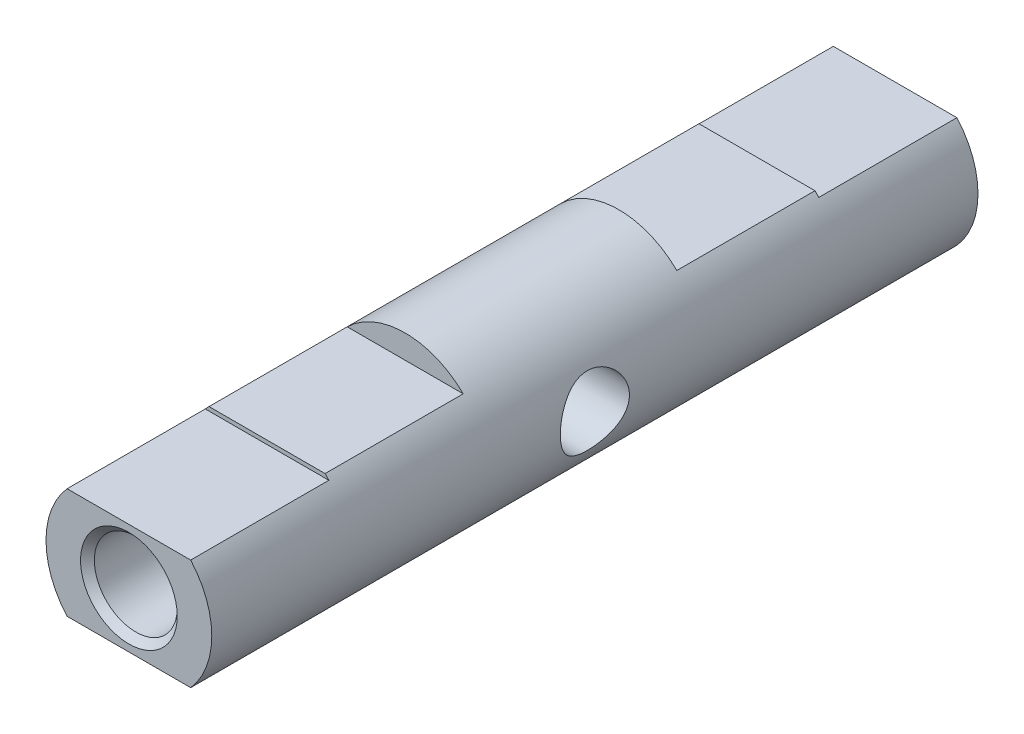
from build123d import *

# Parameters (mm, degrees)
BOSS_EXTRUDE1_DEPTH                                 = 13.865
BOSS_EXTRUDE1_DEPTH_BACK                            = 13.865
SKETCH1_R                                           = 3
CUT_EXTRUDE1_DEPTH                                  = 5
CUT_EXTRUDE2_DEPTH                                  = 5
CUT_EXTRUDE5_DEPTH                                  = 5
CUT_EXTRUDE6_START                                  = -5
CUT_EXTRUDE6_DEPTH                                  = 5
CSK_FOR_M3_COUNTERSUNK_FLAT_HEAD_SCREW1_D           = 3
CSK_FOR_M3_COUNTERSUNK_FLAT_HEAD_SCREW1_DEPTH       = 9.098709071
CSK_FOR_M3_COUNTERSUNK_FLAT_HEAD_SCREW1_CSINK_D     = 3.5
CSK_FOR_M3_COUNTERSUNK_FLAT_HEAD_SCREW1_CSINK_ANGLE = 90
CSK_FOR_M3_COUNTERSUNK_FLAT_HEAD_SCREW1_TIP         = 0.901290929
CSK_FOR_M3_COUNTERSUNK_FLAT_HEAD_SCREW2_D           = 3
CSK_FOR_M3_COUNTERSUNK_FLAT_HEAD_SCREW2_DEPTH       = 9.098709071
CSK_FOR_M3_COUNTERSUNK_FLAT_HEAD_SCREW2_CSINK_D     = 3.5
CSK_FOR_M3_COUNTERSUNK_FLAT_HEAD_SCREW2_CSINK_ANGLE = 90
CSK_FOR_M3_COUNTERSUNK_FLAT_HEAD_SCREW2_TIP         = 0.901290929
SKETCH14_W                                          = 7.4
SKETCH14_H                                          = 4
CUT_EXTRUDE9_DEPTH                                  = 3
SKETCH15_R                                          = 1.25
CUT_EXTRUDE10_DEPTH                                 = 16.157632566


with BuildPart() as part:
    # Sketch1 → Boss-Extrude1 (new, two sides: drawn at the far end of the back side and taken through both)
    with BuildSketch(Plane.XY.offset(-BOSS_EXTRUDE1_DEPTH_BACK)):
        Circle(SKETCH1_R)
    extrude(amount=BOSS_EXTRUDE1_DEPTH + BOSS_EXTRUDE1_DEPTH_BACK)

    # Sketch2 → Cut-Extrude1 (cut)
    with BuildSketch(Plane.XY.offset(13.865)):
        with BuildLine():
            Line((-2.236067977, 2), (2.236067977, 2))
            ThreePointArc((2.236067977, 2), (0, 3), (-2.236067977, 2))
        make_face()
        with BuildLine():
            Line((-2.236067977, -2), (2.236067977, -2))
            ThreePointArc((2.236067977, -2), (0, -3), (-2.236067977, -2))
        make_face()
    extrude(amount=-CUT_EXTRUDE1_DEPTH, mode=Mode.SUBTRACT)

    # Sketch3 → Cut-Extrude2 (cut)
    with BuildSketch(Plane(origin=(0, 0, -13.865), x_dir=(-1, 0, 0), z_dir=(0, 0, -1))):
        with BuildLine():
            Line((-2.236067977, 2), (2.236067977, 2))
            ThreePointArc((2.236067977, 2), (0, 3), (-2.236067977, 2))
        make_face()
        with BuildLine():
            Line((-2.236067977, -2), (2.236067977, -2))
            ThreePointArc((2.236067977, -2), (0, -3), (-2.236067977, -2))
        make_face()
    extrude(amount=-CUT_EXTRUDE2_DEPTH, mode=Mode.SUBTRACT)

    # Sketch4 → Cut-Extrude5 (cut)
    with BuildSketch(Plane(origin=(0, 0, -8.865), x_dir=(-1, 0, 0), z_dir=(0, 0, -1))):
        with BuildLine():
            Line((-2.1, 2.142428529), (2.1, 2.142428529))
            ThreePointArc((2.1, 2.142428529), (0, 3), (-2.1, 2.142428529))
        make_face()
    extrude(amount=-CUT_EXTRUDE5_DEPTH, mode=Mode.SUBTRACT)

    # Sketch5 → Cut-Extrude6 (cut)
    with BuildSketch(Plane.XY.offset(8.865).offset(CUT_EXTRUDE6_START)):
        with BuildLine():
            Line((-2.1, 2.142428529), (2.1, 2.142428529))
            ThreePointArc((2.1, 2.142428529), (0, 3), (-2.1, 2.142428529))
        make_face()
    extrude(amount=CUT_EXTRUDE6_DEPTH, mode=Mode.SUBTRACT)

    # CSK for M3 Countersunk Flat Head Screw1
    with Locations(Plane(origin=(0, 0, -13.865), x_dir=(-1, 0, 0), z_dir=(0, 0, -1))):
        with Locations((0, 0)):
            CounterSinkHole(CSK_FOR_M3_COUNTERSUNK_FLAT_HEAD_SCREW1_D / 2, CSK_FOR_M3_COUNTERSUNK_FLAT_HEAD_SCREW1_CSINK_D / 2, depth=CSK_FOR_M3_COUNTERSUNK_FLAT_HEAD_SCREW1_DEPTH, counter_sink_angle=CSK_FOR_M3_COUNTERSUNK_FLAT_HEAD_SCREW1_CSINK_ANGLE)
            with Locations((0, 0, -(CSK_FOR_M3_COUNTERSUNK_FLAT_HEAD_SCREW1_DEPTH + CSK_FOR_M3_COUNTERSUNK_FLAT_HEAD_SCREW1_TIP / 2))):  # 118° drill point
                Cone(0, CSK_FOR_M3_COUNTERSUNK_FLAT_HEAD_SCREW1_D / 2, CSK_FOR_M3_COUNTERSUNK_FLAT_HEAD_SCREW1_TIP, mode=Mode.SUBTRACT)

    # CSK for M3 Countersunk Flat Head Screw2
    with Locations(Plane.XY.offset(13.865)):
        with Locations((0, 0)):
            CounterSinkHole(CSK_FOR_M3_COUNTERSUNK_FLAT_HEAD_SCREW2_D / 2, CSK_FOR_M3_COUNTERSUNK_FLAT_HEAD_SCREW2_CSINK_D / 2, depth=CSK_FOR_M3_COUNTERSUNK_FLAT_HEAD_SCREW2_DEPTH, counter_sink_angle=CSK_FOR_M3_COUNTERSUNK_FLAT_HEAD_SCREW2_CSINK_ANGLE)
            with Locations((0, 0, -(CSK_FOR_M3_COUNTERSUNK_FLAT_HEAD_SCREW2_DEPTH + CSK_FOR_M3_COUNTERSUNK_FLAT_HEAD_SCREW2_TIP / 2))):  # 118° drill point
                Cone(0, CSK_FOR_M3_COUNTERSUNK_FLAT_HEAD_SCREW2_D / 2, CSK_FOR_M3_COUNTERSUNK_FLAT_HEAD_SCREW2_TIP, mode=Mode.SUBTRACT)

    # Sketch14 → Cut-Extrude9 (cut)
    with BuildSketch(Plane(origin=(-5.34, 0, 0), x_dir=(0, 0, -1), z_dir=(1, 0, 0))):
        Rectangle(SKETCH14_W, SKETCH14_H)
    extrude(amount=CUT_EXTRUDE9_DEPTH, mode=Mode.SUBTRACT)

    # Sketch15 → Cut-Extrude10 (cut, through all)
    with BuildSketch(Plane.ZY.offset(2.34)):
        Circle(SKETCH15_R)
    extrude(amount=-CUT_EXTRUDE10_DEPTH, mode=Mode.SUBTRACT)


solid = part.part
